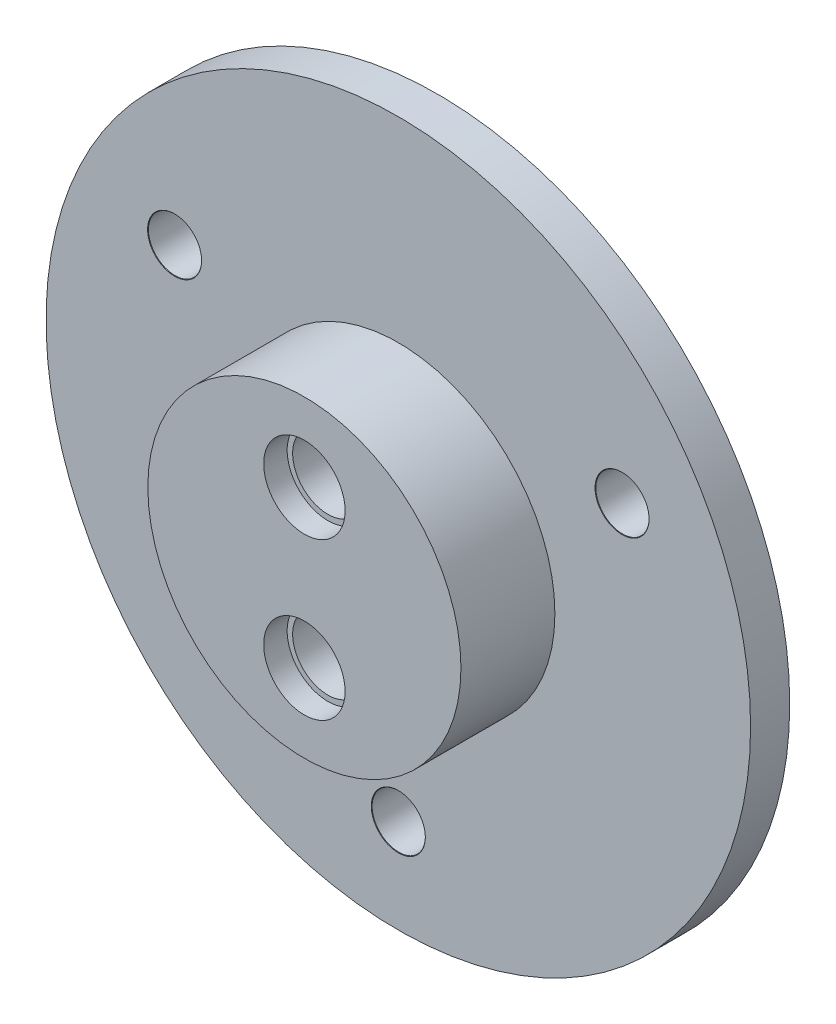
from build123d import *

# Parameters (mm, degrees)
SKETCH1_R                      = 22.5
BOSS_EXTRUDE1_DEPTH            = 2.5
M3_CLEARANCE_HOLE1_D           = 3.4
M3_CLEARANCE_HOLE1_CSINK_D     = 3.45
M3_CLEARANCE_HOLE1_CSINK_ANGLE = 90
SKETCH6_R                      = 10
BOSS_EXTRUDE2_DEPTH            = 6
HOLE2_D                        = 4.5
HOLE2_CBORE_D                  = 5.2
HOLE2_CBORE_DEPTH              = 1.5


with BuildPart() as part:
    # Sketch1 → Boss-Extrude1 (new body)
    with BuildSketch(Plane.XY):
        Circle(SKETCH1_R)
    extrude(amount=BOSS_EXTRUDE1_DEPTH)

    # M3 Clearance Hole1 (through all)
    with Locations(Plane.XY.offset(2.5)):
        with Locations((-14.289419162, 8.25), (14.289419162, 8.25), (0, -16.5)):
            CounterSinkHole(M3_CLEARANCE_HOLE1_D / 2, M3_CLEARANCE_HOLE1_CSINK_D / 2, counter_sink_angle=M3_CLEARANCE_HOLE1_CSINK_ANGLE)

    # Sketch6 → Boss-Extrude2 (add)
    with BuildSketch(Plane.XY.offset(2.5)):
        Circle(SKETCH6_R)
    extrude(amount=BOSS_EXTRUDE2_DEPTH)

    # Hole2 (through all)
    with Locations(Plane.XY.offset(8.5)):
        with Locations((0, 5), (0, -5)):
            CounterBoreHole(HOLE2_D / 2, HOLE2_CBORE_D / 2, HOLE2_CBORE_DEPTH)


solid = part.part
